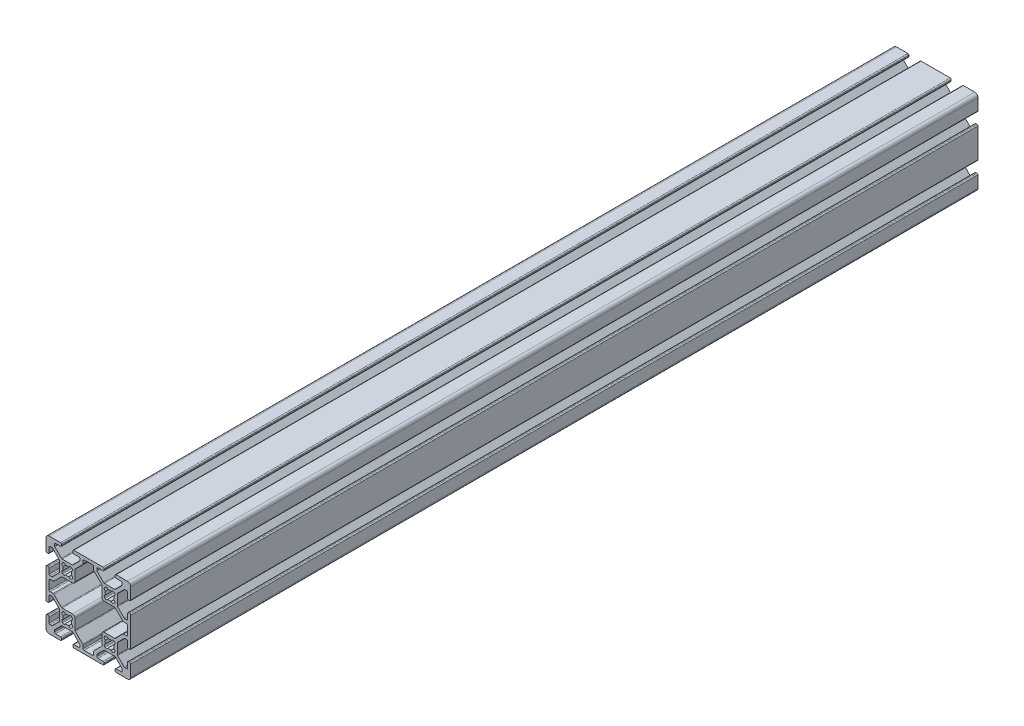
from build123d import *

# Parameters (mm, degrees)
EXTRUDE1_DEPTH = 400


with BuildPart() as part:
    # Sketch1 → Extrude1 (new body)
    with BuildSketch(Plane.XY):
        with BuildLine():
            Line((-36.908207136, -152.779600216), (-32.140368459, -152.779600216))
            ThreePointArc((-32.140368459, -152.779600216), (-31.945965275, -152.818269413), (-31.781158214, -152.928389971))
            Line((-31.781158214, -152.928389971), (-28.678077553, -156.031470632))
            ThreePointArc((-28.678077553, -156.031470632), (-28.567956995, -156.196277694), (-28.529287798, -156.390680877))
            Line((-28.529287798, -156.390680877), (-28.529287798, -157.116600216))
            ThreePointArc((-28.529287798, -157.116600216), (-28.678077553, -157.475810461), (-29.037287798, -157.624600216))
            Line((-29.037287798, -157.624600216), (-31.386287798, -157.624600216))
            ThreePointArc((-31.386287798, -157.624600216), (-31.745498042, -157.773389971), (-31.894287798, -158.132600216))
            Line((-31.894287798, -158.132600216), (-31.894287798, -158.616600216))
            ThreePointArc((-31.894287798, -158.616600216), (-31.745498042, -158.975810461), (-31.386287798, -159.124600216))
            Line((-31.386287798, -159.124600216), (-17.662287798, -159.124600216))
            ThreePointArc((-17.662287798, -159.124600216), (-17.303077553, -158.975810461), (-17.154287798, -158.616600216))
            Line((-17.154287798, -158.616600216), (-17.154287798, -158.132600216))
            ThreePointArc((-17.154287798, -158.132600216), (-17.303077553, -157.773389971), (-17.662287798, -157.624600216))
            Line((-17.662287798, -157.624600216), (-20.011287798, -157.624600216))
            ThreePointArc((-20.011287798, -157.624600216), (-20.370498042, -157.475810461), (-20.519287798, -157.116600216))
            Line((-20.519287798, -157.116600216), (-20.519287798, -156.390680877))
            ThreePointArc((-20.519287798, -156.390680877), (-20.4806186, -156.196277694), (-20.370498042, -156.031470632))
            Line((-20.370498042, -156.031470632), (-17.267417381, -152.928389971))
            ThreePointArc((-17.267417381, -152.928389971), (-17.10261032, -152.818269413), (-16.908207136, -152.779600216))
            Line((-16.908207136, -152.779600216), (-12.140368459, -152.779600216))
            ThreePointArc((-12.140368459, -152.779600216), (-11.945965275, -152.818269413), (-11.781158214, -152.928389971))
            Line((-11.781158214, -152.928389971), (-8.678077553, -156.031470632))
            ThreePointArc((-8.678077553, -156.031470632), (-8.567956995, -156.196277694), (-8.529287798, -156.390680877))
            Line((-8.529287798, -156.390680877), (-8.529287798, -157.116600216))
            ThreePointArc((-8.529287798, -157.116600216), (-8.678077553, -157.475810461), (-9.037287798, -157.624600216))
            Line((-9.037287798, -157.624600216), (-11.386287798, -157.624600216))
            ThreePointArc((-11.386287798, -157.624600216), (-11.745498042, -157.773389971), (-11.894287798, -158.132600216))
            Line((-11.894287798, -158.132600216), (-11.894287798, -158.616600216))
            ThreePointArc((-11.894287798, -158.616600216), (-11.745498042, -158.975810461), (-11.386287798, -159.124600216))
            Line((-11.386287798, -159.124600216), (-6.024287798, -159.124600216))
            ThreePointArc((-6.024287798, -159.124600216), (-4.963627626, -158.685260388), (-4.524287798, -157.624600216))
            Line((-4.524287798, -157.624600216), (-4.524287798, -152.262600216))
            ThreePointArc((-4.524287798, -152.262600216), (-4.673077553, -151.903389971), (-5.032287798, -151.754600216))
            Line((-5.032287798, -151.754600216), (-5.516287798, -151.754600216))
            ThreePointArc((-5.516287798, -151.754600216), (-5.875498042, -151.903389971), (-6.024287798, -152.262600216))
            Line((-6.024287798, -152.262600216), (-6.024287798, -154.611600216))
            ThreePointArc((-6.024287798, -154.611600216), (-6.173077553, -154.970810461), (-6.532287798, -155.119600216))
            Line((-6.532287798, -155.119600216), (-7.258207136, -155.119600216))
            ThreePointArc((-7.258207136, -155.119600216), (-7.45261032, -155.080931018), (-7.617417381, -154.970810461))
            Line((-7.617417381, -154.970810461), (-10.720498042, -151.867729799))
            ThreePointArc((-10.720498042, -151.867729799), (-10.8306186, -151.702922738), (-10.869287798, -151.508519554))
            Line((-10.869287798, -151.508519554), (-10.869287798, -146.740680877))
            ThreePointArc((-10.869287798, -146.740680877), (-10.8306186, -146.546277694), (-10.720498042, -146.381470632))
            Line((-10.720498042, -146.381470632), (-7.617417381, -143.278389971))
            ThreePointArc((-7.617417381, -143.278389971), (-7.45261032, -143.168269413), (-7.258207136, -143.129600216))
            Line((-7.258207136, -143.129600216), (-6.532287798, -143.129600216))
            ThreePointArc((-6.532287798, -143.129600216), (-6.173077553, -143.278389971), (-6.024287798, -143.637600216))
            Line((-6.024287798, -143.637600216), (-6.024287798, -145.986600216))
            ThreePointArc((-6.024287798, -145.986600216), (-5.875498042, -146.345810461), (-5.516287798, -146.494600216))
            Line((-5.516287798, -146.494600216), (-5.032287798, -146.494600216))
            ThreePointArc((-5.032287798, -146.494600216), (-4.673077553, -146.345810461), (-4.524287798, -145.986600216))
            Line((-4.524287798, -145.986600216), (-4.524287798, -132.262600216))
            ThreePointArc((-4.524287798, -132.262600216), (-4.673077553, -131.903389971), (-5.032287798, -131.754600216))
            Line((-5.032287798, -131.754600216), (-5.516287798, -131.754600216))
            ThreePointArc((-5.516287798, -131.754600216), (-5.875498042, -131.903389971), (-6.024287798, -132.262600216))
            Line((-6.024287798, -132.262600216), (-6.024287798, -134.611600216))
            ThreePointArc((-6.024287798, -134.611600216), (-6.173077553, -134.970810461), (-6.532287798, -135.119600216))
            Line((-6.532287798, -135.119600216), (-7.258207136, -135.119600216))
            ThreePointArc((-7.258207136, -135.119600216), (-7.45261032, -135.080931018), (-7.617417381, -134.970810461))
            Line((-7.617417381, -134.970810461), (-10.720498042, -131.867729799))
            ThreePointArc((-10.720498042, -131.867729799), (-10.8306186, -131.702922738), (-10.869287798, -131.508519554))
            Line((-10.869287798, -131.508519554), (-10.869287798, -126.740680877))
            ThreePointArc((-10.869287798, -126.740680877), (-10.8306186, -126.546277694), (-10.720498042, -126.381470632))
            Line((-10.720498042, -126.381470632), (-7.617417381, -123.278389971))
            ThreePointArc((-7.617417381, -123.278389971), (-7.45261032, -123.168269413), (-7.258207136, -123.129600216))
            Line((-7.258207136, -123.129600216), (-6.532287798, -123.129600216))
            ThreePointArc((-6.532287798, -123.129600216), (-6.173077553, -123.278389971), (-6.024287798, -123.637600216))
            Line((-6.024287798, -123.637600216), (-6.024287798, -125.986600216))
            ThreePointArc((-6.024287798, -125.986600216), (-5.875498042, -126.345810461), (-5.516287798, -126.494600216))
            Line((-5.516287798, -126.494600216), (-5.032287798, -126.494600216))
            ThreePointArc((-5.032287798, -126.494600216), (-4.673077553, -126.345810461), (-4.524287798, -125.986600216))
            Line((-4.524287798, -125.986600216), (-4.524287798, -120.624600216))
            ThreePointArc((-4.524287798, -120.624600216), (-4.963627626, -119.563940044), (-6.024287798, -119.124600216))
            Line((-6.024287798, -119.124600216), (-11.386287798, -119.124600216))
            ThreePointArc((-11.386287798, -119.124600216), (-11.745498042, -119.273389971), (-11.894287798, -119.632600216))
            Line((-11.894287798, -119.632600216), (-11.894287798, -120.116600216))
            ThreePointArc((-11.894287798, -120.116600216), (-11.745498042, -120.475810461), (-11.386287798, -120.624600216))
            Line((-11.386287798, -120.624600216), (-9.037287798, -120.624600216))
            ThreePointArc((-9.037287798, -120.624600216), (-8.678077553, -120.773389971), (-8.529287798, -121.132600216))
            Line((-8.529287798, -121.132600216), (-8.529287798, -121.858519554))
            ThreePointArc((-8.529287798, -121.858519554), (-8.567956995, -122.052922738), (-8.678077553, -122.217729799))
            Line((-8.678077553, -122.217729799), (-11.781158214, -125.320810461))
            ThreePointArc((-11.781158214, -125.320810461), (-11.945965275, -125.430931018), (-12.140368459, -125.469600216))
            Line((-12.140368459, -125.469600216), (-16.908207136, -125.469600216))
            ThreePointArc((-16.908207136, -125.469600216), (-17.10261032, -125.430931018), (-17.267417381, -125.320810461))
            Line((-17.267417381, -125.320810461), (-20.370498042, -122.217729799))
            ThreePointArc((-20.370498042, -122.217729799), (-20.4806186, -122.052922738), (-20.519287798, -121.858519554))
            Line((-20.519287798, -121.858519554), (-20.519287798, -121.132600216))
            ThreePointArc((-20.519287798, -121.132600216), (-20.370498042, -120.773389971), (-20.011287798, -120.624600216))
            Line((-20.011287798, -120.624600216), (-17.662287798, -120.624600216))
            ThreePointArc((-17.662287798, -120.624600216), (-17.303077553, -120.475810461), (-17.154287798, -120.116600216))
            Line((-17.154287798, -120.116600216), (-17.154287798, -119.632600216))
            ThreePointArc((-17.154287798, -119.632600216), (-17.303077553, -119.273389971), (-17.662287798, -119.124600216))
            Line((-17.662287798, -119.124600216), (-31.386287798, -119.124600216))
            ThreePointArc((-31.386287798, -119.124600216), (-31.745498042, -119.273389971), (-31.894287798, -119.632600216))
            Line((-31.894287798, -119.632600216), (-31.894287798, -120.116600216))
            ThreePointArc((-31.894287798, -120.116600216), (-31.745498042, -120.475810461), (-31.386287798, -120.624600216))
            Line((-31.386287798, -120.624600216), (-29.037287798, -120.624600216))
            ThreePointArc((-29.037287798, -120.624600216), (-28.678077553, -120.773389971), (-28.529287798, -121.132600216))
            Line((-28.529287798, -121.132600216), (-28.529287798, -121.858519554))
            ThreePointArc((-28.529287798, -121.858519554), (-28.567956995, -122.052922738), (-28.678077553, -122.217729799))
            Line((-28.678077553, -122.217729799), (-31.781158214, -125.320810461))
            ThreePointArc((-31.781158214, -125.320810461), (-31.945965275, -125.430931018), (-32.140368459, -125.469600216))
            Line((-32.140368459, -125.469600216), (-36.908207136, -125.469600216))
            ThreePointArc((-36.908207136, -125.469600216), (-37.10261032, -125.430931018), (-37.267417381, -125.320810461))
            Line((-37.267417381, -125.320810461), (-40.370498042, -122.217729799))
            ThreePointArc((-40.370498042, -122.217729799), (-40.4806186, -122.052922738), (-40.519287798, -121.858519554))
            Line((-40.519287798, -121.858519554), (-40.519287798, -121.132600216))
            ThreePointArc((-40.519287798, -121.132600216), (-40.370498042, -120.773389971), (-40.011287798, -120.624600216))
            Line((-40.011287798, -120.624600216), (-37.662287798, -120.624600216))
            ThreePointArc((-37.662287798, -120.624600216), (-37.303077553, -120.475810461), (-37.154287798, -120.116600216))
            Line((-37.154287798, -120.116600216), (-37.154287798, -119.632600216))
            ThreePointArc((-37.154287798, -119.632600216), (-37.303077553, -119.273389971), (-37.662287798, -119.124600216))
            Line((-37.662287798, -119.124600216), (-43.024287798, -119.124600216))
            ThreePointArc((-43.024287798, -119.124600216), (-44.084947969, -119.563940044), (-44.524287798, -120.624600216))
            Line((-44.524287798, -120.624600216), (-44.524287798, -125.986600216))
            ThreePointArc((-44.524287798, -125.986600216), (-44.375498042, -126.345810461), (-44.016287798, -126.494600216))
            Line((-44.016287798, -126.494600216), (-43.532287798, -126.494600216))
            ThreePointArc((-43.532287798, -126.494600216), (-43.173077553, -126.345810461), (-43.024287798, -125.986600216))
            Line((-43.024287798, -125.986600216), (-43.024287798, -123.637600216))
            ThreePointArc((-43.024287798, -123.637600216), (-42.875498042, -123.278389971), (-42.516287798, -123.129600216))
            Line((-42.516287798, -123.129600216), (-41.790368459, -123.129600216))
            ThreePointArc((-41.790368459, -123.129600216), (-41.595965275, -123.168269413), (-41.431158214, -123.278389971))
            Line((-41.431158214, -123.278389971), (-38.328077553, -126.381470632))
            ThreePointArc((-38.328077553, -126.381470632), (-38.217956995, -126.546277694), (-38.179287798, -126.740680877))
            Line((-38.179287798, -126.740680877), (-38.179287798, -131.508519554))
            ThreePointArc((-38.179287798, -131.508519554), (-38.217956995, -131.702922738), (-38.328077553, -131.867729799))
            Line((-38.328077553, -131.867729799), (-41.431158214, -134.970810461))
            ThreePointArc((-41.431158214, -134.970810461), (-41.595965275, -135.080931018), (-41.790368459, -135.119600216))
            Line((-41.790368459, -135.119600216), (-42.516287798, -135.119600216))
            ThreePointArc((-42.516287798, -135.119600216), (-42.875498042, -134.970810461), (-43.024287798, -134.611600216))
            Line((-43.024287798, -134.611600216), (-43.024287798, -132.262600216))
            ThreePointArc((-43.024287798, -132.262600216), (-43.173077553, -131.903389971), (-43.532287798, -131.754600216))
            Line((-43.532287798, -131.754600216), (-44.016287798, -131.754600216))
            ThreePointArc((-44.016287798, -131.754600216), (-44.375498042, -131.903389971), (-44.524287798, -132.262600216))
            Line((-44.524287798, -132.262600216), (-44.524287798, -145.986600216))
            ThreePointArc((-44.524287798, -145.986600216), (-44.375498042, -146.345810461), (-44.016287798, -146.494600216))
            Line((-44.016287798, -146.494600216), (-43.532287798, -146.494600216))
            ThreePointArc((-43.532287798, -146.494600216), (-43.173077553, -146.345810461), (-43.024287798, -145.986600216))
            Line((-43.024287798, -145.986600216), (-43.024287798, -143.637600216))
            ThreePointArc((-43.024287798, -143.637600216), (-42.875498042, -143.278389971), (-42.516287798, -143.129600216))
            Line((-42.516287798, -143.129600216), (-41.790368459, -143.129600216))
            ThreePointArc((-41.790368459, -143.129600216), (-41.595965275, -143.168269413), (-41.431158214, -143.278389971))
            Line((-41.431158214, -143.278389971), (-38.328077553, -146.381470632))
            ThreePointArc((-38.328077553, -146.381470632), (-38.217956995, -146.546277694), (-38.179287798, -146.740680877))
            Line((-38.179287798, -146.740680877), (-38.179287798, -151.508519554))
            ThreePointArc((-38.179287798, -151.508519554), (-38.217956995, -151.702922738), (-38.328077553, -151.867729799))
            Line((-38.328077553, -151.867729799), (-41.431158214, -154.970810461))
            ThreePointArc((-41.431158214, -154.970810461), (-41.595965275, -155.080931018), (-41.790368459, -155.119600216))
            Line((-41.790368459, -155.119600216), (-42.516287798, -155.119600216))
            ThreePointArc((-42.516287798, -155.119600216), (-42.875498042, -154.970810461), (-43.024287798, -154.611600216))
            Line((-43.024287798, -154.611600216), (-43.024287798, -152.262600216))
            ThreePointArc((-43.024287798, -152.262600216), (-43.173077553, -151.903389971), (-43.532287798, -151.754600216))
            Line((-43.532287798, -151.754600216), (-44.016287798, -151.754600216))
            ThreePointArc((-44.016287798, -151.754600216), (-44.375498042, -151.903389971), (-44.524287798, -152.262600216))
            Line((-44.524287798, -152.262600216), (-44.524287798, -157.624600216))
            ThreePointArc((-44.524287798, -157.624600216), (-44.084947969, -158.685260388), (-43.024287798, -159.124600216))
            Line((-43.024287798, -159.124600216), (-37.662287798, -159.124600216))
            ThreePointArc((-37.662287798, -159.124600216), (-37.303077553, -158.975810461), (-37.154287798, -158.616600216))
            Line((-37.154287798, -158.616600216), (-37.154287798, -158.132600216))
            ThreePointArc((-37.154287798, -158.132600216), (-37.303077553, -157.773389971), (-37.662287798, -157.624600216))
            Line((-37.662287798, -157.624600216), (-40.011287798, -157.624600216))
            ThreePointArc((-40.011287798, -157.624600216), (-40.370498042, -157.475810461), (-40.519287798, -157.116600216))
            Line((-40.519287798, -157.116600216), (-40.519287798, -156.390680877))
            ThreePointArc((-40.519287798, -156.390680877), (-40.4806186, -156.196277694), (-40.370498042, -156.031470632))
            Line((-40.370498042, -156.031470632), (-37.267417381, -152.928389971))
            ThreePointArc((-37.267417381, -152.928389971), (-37.10261032, -152.818269413), (-36.908207136, -152.779600216))
        make_face()
        with BuildLine():
            Line((-16.649188641, -131.429106182), (-16.828793764, -131.249501059))
            ThreePointArc((-16.828793764, -131.249501059), (-17.030225814, -130.481068027), (-16.459421304, -129.928576934))
            ThreePointArc((-16.459421304, -129.928576934), (-16.619787798, -129.124600216), (-16.459421304, -128.320623498))
            ThreePointArc((-16.459421304, -128.320623498), (-17.030225814, -127.768132405), (-16.828793764, -126.999699372))
            Line((-16.828793764, -126.999699372), (-16.649188641, -126.82009425))
            ThreePointArc((-16.649188641, -126.82009425), (-15.880755608, -126.618662199), (-15.328264516, -127.18946671))
            ThreePointArc((-15.328264516, -127.18946671), (-14.524287798, -127.029100216), (-13.72031108, -127.18946671))
            ThreePointArc((-13.72031108, -127.18946671), (-13.167819987, -126.618662199), (-12.399386954, -126.82009425))
            Line((-12.399386954, -126.82009425), (-12.219781831, -126.999699372))
            ThreePointArc((-12.219781831, -126.999699372), (-12.018349781, -127.768132405), (-12.589154291, -128.320623498))
            ThreePointArc((-12.589154291, -128.320623498), (-12.428787798, -129.124600216), (-12.589154291, -129.928576934))
            ThreePointArc((-12.589154291, -129.928576934), (-12.018349781, -130.481068027), (-12.219781831, -131.249501059))
            Line((-12.219781831, -131.249501059), (-12.399386954, -131.429106182))
            ThreePointArc((-12.399386954, -131.429106182), (-13.167819987, -131.630538232), (-13.72031108, -131.059733722))
            ThreePointArc((-13.72031108, -131.059733722), (-14.524287798, -131.220100216), (-15.328264516, -131.059733722))
            ThreePointArc((-15.328264516, -131.059733722), (-15.880755608, -131.630538232), (-16.649188641, -131.429106182))
        make_face(mode=Mode.SUBTRACT)
        with BuildLine():
            Line((-36.649188641, -131.429106182), (-36.828793764, -131.249501059))
            ThreePointArc((-36.828793764, -131.249501059), (-37.030225814, -130.481068027), (-36.459421304, -129.928576934))
            ThreePointArc((-36.459421304, -129.928576934), (-36.619787798, -129.124600216), (-36.459421304, -128.320623498))
            ThreePointArc((-36.459421304, -128.320623498), (-37.030225814, -127.768132405), (-36.828793764, -126.999699372))
            Line((-36.828793764, -126.999699372), (-36.649188641, -126.82009425))
            ThreePointArc((-36.649188641, -126.82009425), (-35.880755608, -126.618662199), (-35.328264516, -127.18946671))
            ThreePointArc((-35.328264516, -127.18946671), (-34.524287798, -127.029100216), (-33.72031108, -127.18946671))
            ThreePointArc((-33.72031108, -127.18946671), (-33.167819987, -126.618662199), (-32.399386954, -126.82009425))
            Line((-32.399386954, -126.82009425), (-32.219781831, -126.999699372))
            ThreePointArc((-32.219781831, -126.999699372), (-32.018349781, -127.768132405), (-32.589154291, -128.320623498))
            ThreePointArc((-32.589154291, -128.320623498), (-32.428787798, -129.124600216), (-32.589154291, -129.928576934))
            ThreePointArc((-32.589154291, -129.928576934), (-32.018349781, -130.481068027), (-32.219781831, -131.249501059))
            Line((-32.219781831, -131.249501059), (-32.399386954, -131.429106182))
            ThreePointArc((-32.399386954, -131.429106182), (-33.167819987, -131.630538232), (-33.72031108, -131.059733722))
            ThreePointArc((-33.72031108, -131.059733722), (-34.524287798, -131.220100216), (-35.328264516, -131.059733722))
            ThreePointArc((-35.328264516, -131.059733722), (-35.880755608, -131.630538232), (-36.649188641, -131.429106182))
        make_face(mode=Mode.SUBTRACT)
        with BuildLine():
            Line((-16.649188641, -151.429106182), (-16.828793764, -151.249501059))
            ThreePointArc((-16.828793764, -151.249501059), (-17.030225814, -150.481068027), (-16.459421304, -149.928576934))
            ThreePointArc((-16.459421304, -149.928576934), (-16.619787798, -149.124600216), (-16.459421304, -148.320623498))
            ThreePointArc((-16.459421304, -148.320623498), (-17.030225814, -147.768132405), (-16.828793764, -146.999699372))
            Line((-16.828793764, -146.999699372), (-16.649188641, -146.82009425))
            ThreePointArc((-16.649188641, -146.82009425), (-15.880755608, -146.618662199), (-15.328264516, -147.18946671))
            ThreePointArc((-15.328264516, -147.18946671), (-14.524287798, -147.029100216), (-13.72031108, -147.18946671))
            ThreePointArc((-13.72031108, -147.18946671), (-13.167819987, -146.618662199), (-12.399386954, -146.82009425))
            Line((-12.399386954, -146.82009425), (-12.219781831, -146.999699372))
            ThreePointArc((-12.219781831, -146.999699372), (-12.018349781, -147.768132405), (-12.589154291, -148.320623498))
            ThreePointArc((-12.589154291, -148.320623498), (-12.428787798, -149.124600216), (-12.589154291, -149.928576934))
            ThreePointArc((-12.589154291, -149.928576934), (-12.018349781, -150.481068027), (-12.219781831, -151.249501059))
            Line((-12.219781831, -151.249501059), (-12.399386954, -151.429106182))
            ThreePointArc((-12.399386954, -151.429106182), (-13.167819987, -151.630538232), (-13.72031108, -151.059733722))
            ThreePointArc((-13.72031108, -151.059733722), (-14.524287798, -151.220100216), (-15.328264516, -151.059733722))
            ThreePointArc((-15.328264516, -151.059733722), (-15.880755608, -151.630538232), (-16.649188641, -151.429106182))
        make_face(mode=Mode.SUBTRACT)
        with BuildLine():
            Line((-27.029287798, -157.116600216), (-27.029287798, -155.769360534))
            ThreePointArc((-27.029287798, -155.769360534), (-27.067956995, -155.57495735), (-27.178077553, -155.410150289))
            Line((-27.178077553, -155.410150289), (-30.720498042, -151.867729799))
            ThreePointArc((-30.720498042, -151.867729799), (-30.8306186, -151.702922738), (-30.869287798, -151.508519554))
            Line((-30.869287798, -151.508519554), (-30.869287798, -146.612600216))
            ThreePointArc((-30.869287798, -146.612600216), (-31.204064747, -145.804377165), (-32.012287798, -145.469600216))
            Line((-32.012287798, -145.469600216), (-36.908207136, -145.469600216))
            ThreePointArc((-36.908207136, -145.469600216), (-37.10261032, -145.430931018), (-37.267417381, -145.320810461))
            Line((-37.267417381, -145.320810461), (-40.809837871, -141.778389971))
            ThreePointArc((-40.809837871, -141.778389971), (-40.974644932, -141.668269413), (-41.169048116, -141.629600216))
            Line((-41.169048116, -141.629600216), (-42.516287798, -141.629600216))
            ThreePointArc((-42.516287798, -141.629600216), (-42.875498042, -141.480810461), (-43.024287798, -141.121600216))
            Line((-43.024287798, -141.121600216), (-43.024287798, -137.127600216))
            ThreePointArc((-43.024287798, -137.127600216), (-42.875498042, -136.768389971), (-42.516287798, -136.619600216))
            Line((-42.516287798, -136.619600216), (-41.169048116, -136.619600216))
            ThreePointArc((-41.169048116, -136.619600216), (-40.974644932, -136.580931018), (-40.809837871, -136.470810461))
            Line((-40.809837871, -136.470810461), (-37.267417381, -132.928389971))
            ThreePointArc((-37.267417381, -132.928389971), (-37.10261032, -132.818269413), (-36.908207136, -132.779600216))
            Line((-36.908207136, -132.779600216), (-32.012287798, -132.779600216))
            ThreePointArc((-32.012287798, -132.779600216), (-31.204064747, -132.444823267), (-30.869287798, -131.636600216))
            Line((-30.869287798, -131.636600216), (-30.869287798, -126.740680877))
            ThreePointArc((-30.869287798, -126.740680877), (-30.8306186, -126.546277694), (-30.720498042, -126.381470632))
            Line((-30.720498042, -126.381470632), (-27.178077553, -122.839050143))
            ThreePointArc((-27.178077553, -122.839050143), (-27.067956995, -122.674243081), (-27.029287798, -122.479839898))
            Line((-27.029287798, -122.479839898), (-27.029287798, -121.132600216))
            ThreePointArc((-27.029287798, -121.132600216), (-26.880498042, -120.773389971), (-26.521287798, -120.624600216))
            Line((-26.521287798, -120.624600216), (-22.527287798, -120.624600216))
            ThreePointArc((-22.527287798, -120.624600216), (-22.168077553, -120.773389971), (-22.019287798, -121.132600216))
            Line((-22.019287798, -121.132600216), (-22.019287798, -122.479839898))
            ThreePointArc((-22.019287798, -122.479839898), (-21.9806186, -122.674243081), (-21.870498042, -122.839050143))
            Line((-21.870498042, -122.839050143), (-18.328077553, -126.381470632))
            ThreePointArc((-18.328077553, -126.381470632), (-18.217956995, -126.546277694), (-18.179287798, -126.740680877))
            Line((-18.179287798, -126.740680877), (-18.179287798, -131.636600216))
            ThreePointArc((-18.179287798, -131.636600216), (-17.844510848, -132.444823267), (-17.036287798, -132.779600216))
            Line((-17.036287798, -132.779600216), (-12.140368459, -132.779600216))
            ThreePointArc((-12.140368459, -132.779600216), (-11.945965275, -132.818269413), (-11.781158214, -132.928389971))
            Line((-11.781158214, -132.928389971), (-8.238737725, -136.470810461))
            ThreePointArc((-8.238737725, -136.470810461), (-8.073930663, -136.580931018), (-7.87952748, -136.619600216))
            Line((-7.87952748, -136.619600216), (-6.532287798, -136.619600216))
            ThreePointArc((-6.532287798, -136.619600216), (-6.173077553, -136.768389971), (-6.024287798, -137.127600216))
            Line((-6.024287798, -137.127600216), (-6.024287798, -141.121600216))
            ThreePointArc((-6.024287798, -141.121600216), (-6.173077553, -141.480810461), (-6.532287798, -141.629600216))
            Line((-6.532287798, -141.629600216), (-7.87952748, -141.629600216))
            ThreePointArc((-7.87952748, -141.629600216), (-8.073930663, -141.668269413), (-8.238737725, -141.778389971))
            Line((-8.238737725, -141.778389971), (-11.781158214, -145.320810461))
            ThreePointArc((-11.781158214, -145.320810461), (-11.945965275, -145.430931018), (-12.140368459, -145.469600216))
            Line((-12.140368459, -145.469600216), (-17.036287798, -145.469600216))
            ThreePointArc((-17.036287798, -145.469600216), (-17.844510848, -145.804377165), (-18.179287798, -146.612600216))
            Line((-18.179287798, -146.612600216), (-18.179287798, -151.508519554))
            ThreePointArc((-18.179287798, -151.508519554), (-18.217956995, -151.702922738), (-18.328077553, -151.867729799))
            Line((-18.328077553, -151.867729799), (-21.870498042, -155.410150289))
            ThreePointArc((-21.870498042, -155.410150289), (-21.9806186, -155.57495735), (-22.019287798, -155.769360534))
            Line((-22.019287798, -155.769360534), (-22.019287798, -157.116600216))
            ThreePointArc((-22.019287798, -157.116600216), (-22.168077553, -157.475810461), (-22.527287798, -157.624600216))
            Line((-22.527287798, -157.624600216), (-26.521287798, -157.624600216))
            ThreePointArc((-26.521287798, -157.624600216), (-26.880498042, -157.475810461), (-27.029287798, -157.116600216))
        make_face(mode=Mode.SUBTRACT)
        with BuildLine():
            Line((-36.649188641, -151.429106182), (-36.828793764, -151.249501059))
            ThreePointArc((-36.828793764, -151.249501059), (-37.030225814, -150.481068027), (-36.459421304, -149.928576934))
            ThreePointArc((-36.459421304, -149.928576934), (-36.619787798, -149.124600216), (-36.459421304, -148.320623498))
            ThreePointArc((-36.459421304, -148.320623498), (-37.030225814, -147.768132405), (-36.828793764, -146.999699372))
            Line((-36.828793764, -146.999699372), (-36.649188641, -146.82009425))
            ThreePointArc((-36.649188641, -146.82009425), (-35.880755608, -146.618662199), (-35.328264516, -147.18946671))
            ThreePointArc((-35.328264516, -147.18946671), (-34.524287798, -147.029100216), (-33.72031108, -147.18946671))
            ThreePointArc((-33.72031108, -147.18946671), (-33.167819987, -146.618662199), (-32.399386954, -146.82009425))
            Line((-32.399386954, -146.82009425), (-32.219781831, -146.999699372))
            ThreePointArc((-32.219781831, -146.999699372), (-32.018349781, -147.768132405), (-32.589154291, -148.320623498))
            ThreePointArc((-32.589154291, -148.320623498), (-32.428787798, -149.124600216), (-32.589154291, -149.928576934))
            ThreePointArc((-32.589154291, -149.928576934), (-32.018349781, -150.481068027), (-32.219781831, -151.249501059))
            Line((-32.219781831, -151.249501059), (-32.399386954, -151.429106182))
            ThreePointArc((-32.399386954, -151.429106182), (-33.167819987, -151.630538232), (-33.72031108, -151.059733722))
            ThreePointArc((-33.72031108, -151.059733722), (-34.524287798, -151.220100216), (-35.328264516, -151.059733722))
            ThreePointArc((-35.328264516, -151.059733722), (-35.880755608, -151.630538232), (-36.649188641, -151.429106182))
        make_face(mode=Mode.SUBTRACT)
    extrude(amount=EXTRUDE1_DEPTH)


solid = part.part
